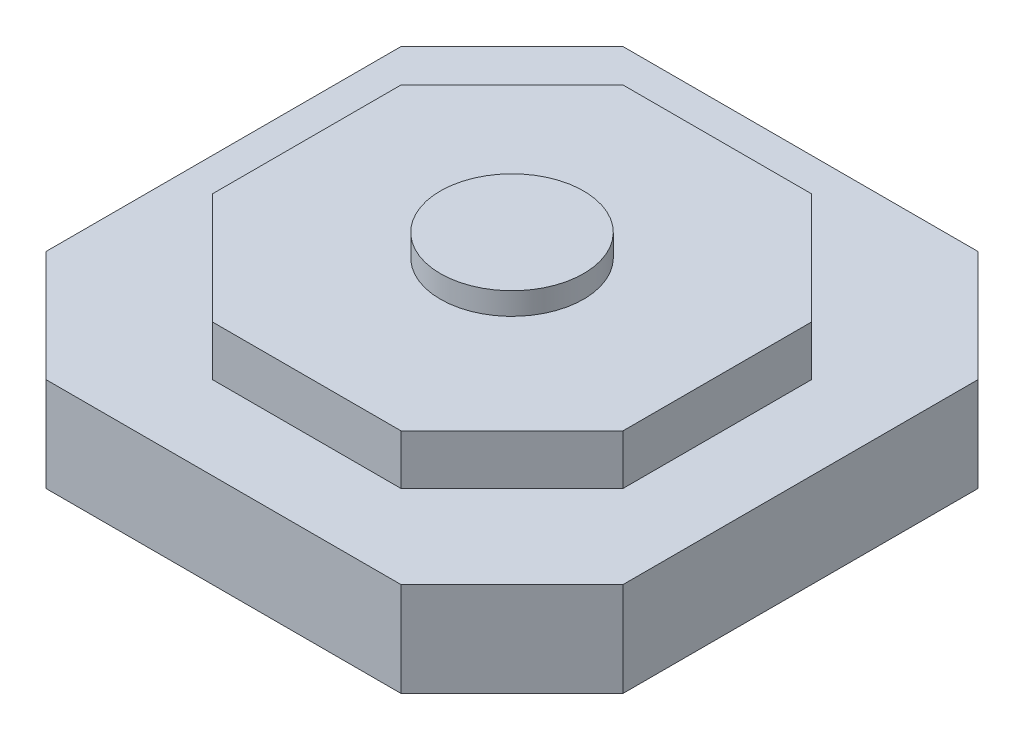
from build123d import *

# Parameters (mm, degrees)
SKETCH_1_W      = 5.2
SKETCH_1_H      = 5.2
EXTRUDE_1_DEPTH = 0.85
CHAMFER_1_SIZE  = 1
SKETCH_2_W      = 3.7
SKETCH_2_H      = 3.7
EXTRUDE_2_DEPTH = 0.45
CHAMFER_2_SIZE  = 1
SKETCH_3_R      = 0.645603451
EXTRUDE_3_DEPTH = 0.2


with BuildPart() as part:
    # 草图1 → 凸台-拉伸1 (new body)
    with BuildSketch(Plane(origin=(0, 0, 0), x_dir=(1, 0, 0), z_dir=(0, 1, 0))):
        Rectangle(SKETCH_1_W, SKETCH_1_H)
    extrude(amount=EXTRUDE_1_DEPTH)

    # 倒角1
    chamfer_1_edges = [part.edges().sort_by_distance(p)[0] for p in [
        (2.6, 0.425, 2.6),
        (-2.6, 0.425, 2.6),
        (-2.6, 0.425, -2.6),
        (2.6, 0.425, -2.6),
    ]]
    chamfer(chamfer_1_edges, length=CHAMFER_1_SIZE)

    # 草图2 → 凸台-拉伸2 (add)
    with BuildSketch(Plane(origin=(0, 0.85, 0), x_dir=(1, 0, 0), z_dir=(0, 1, 0))):
        Rectangle(SKETCH_2_W, SKETCH_2_H)
    extrude(amount=EXTRUDE_2_DEPTH)

    # 倒角2
    chamfer_2_edges = [part.edges().sort_by_distance(p)[0] for p in [
        (1.85, 1.075, 1.85),
        (1.85, 1.075, -1.85),
        (-1.85, 1.075, -1.85),
        (-1.85, 1.075, 1.85),
    ]]
    chamfer(chamfer_2_edges, length=CHAMFER_2_SIZE)

    # 草图3 → 凸台-拉伸3 (add)
    with BuildSketch(Plane(origin=(0, 1.3, 0), x_dir=(1, 0, 0), z_dir=(0, 1, 0))):
        with Locations(Location((0, 0, 0), (0, 0, 270))):
            Circle(SKETCH_3_R)
    extrude(amount=EXTRUDE_3_DEPTH)


solid = part.part
